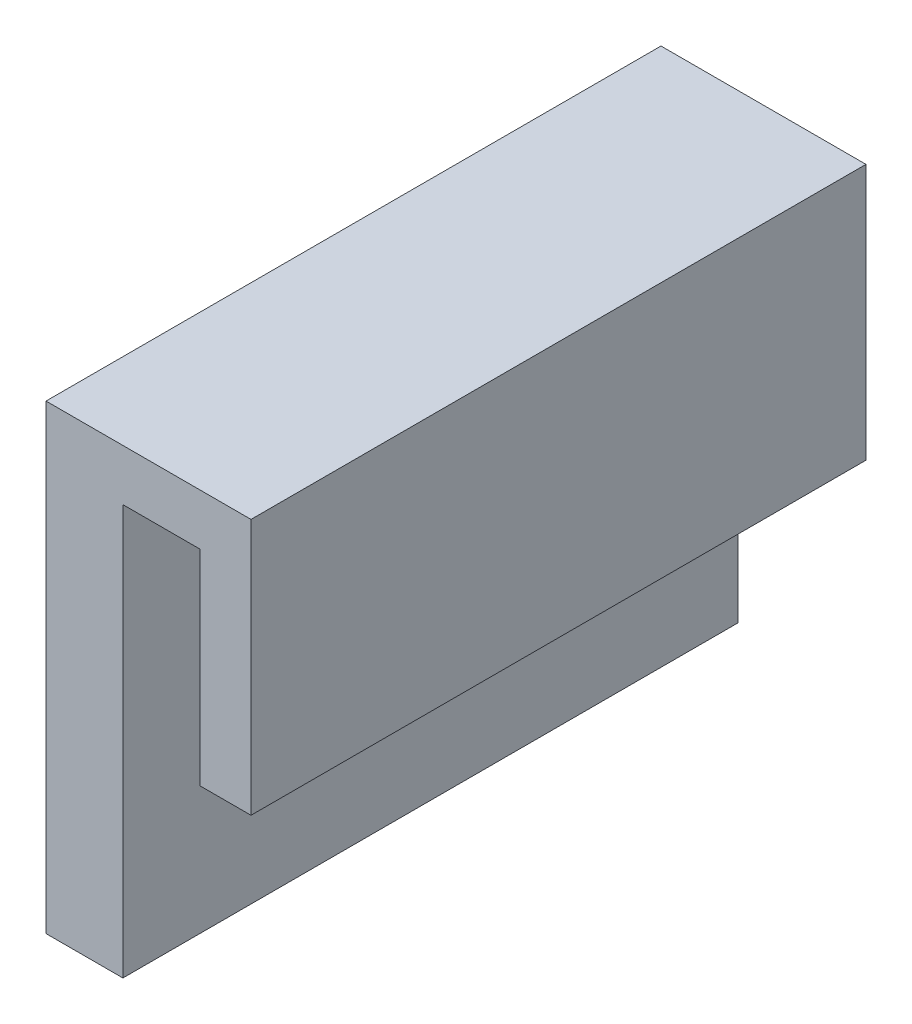
from build123d import *

# Parameters (mm, degrees)
EXTRUDE_1_DEPTH = 12


with BuildPart() as part:
    # 草图1 → 凸台-拉伸1 (new body)
    with BuildSketch(Plane.XY):
        Polygon((0, 0), (0, -8), (1.5, -8), (1.5, 0), (3, 0), (3, -4), (4, -4), (4, 1), (0, 1), align=None)
    extrude(amount=EXTRUDE_1_DEPTH)


solid = part.part
